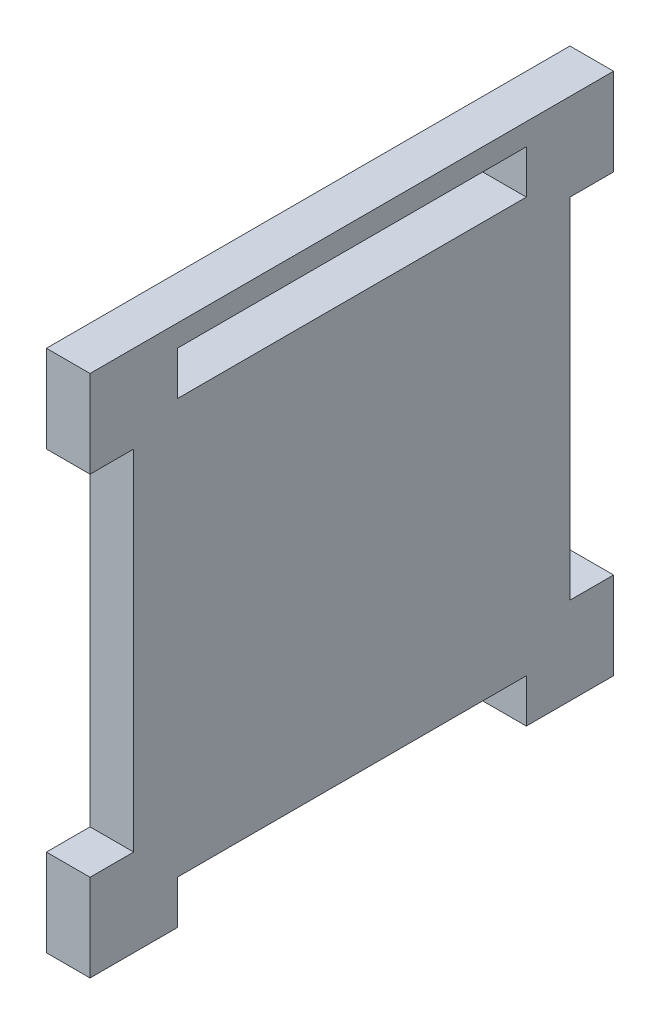
from build123d import *

# Parameters (mm, degrees)
SKETCH1_W           = 6.35
SKETCH1_H           = 76.2
BOSS_EXTRUDE1_DEPTH = 63.5
SKETCH2_W           = 6.35
SKETCH2_H           = 12.7
BOSS_EXTRUDE2_DEPTH = 6.35
SKETCH3_W           = 50.8
SKETCH3_H           = 6.35
CUT_EXTRUDE1_DEPTH  = 80.818262321


with BuildPart() as part:
    # Sketch1 → Boss-Extrude1 (new body)
    with BuildSketch(Plane.XY):
        with Locations((111.125, 0)):
            Rectangle(SKETCH1_W, SKETCH1_H)
    extrude(amount=BOSS_EXTRUDE1_DEPTH)

    # Sketch2 → Boss-Extrude2 (add)
    with BuildSketch(Plane(origin=(114.3, 0, 0), x_dir=(0, 0, -1), z_dir=(1, 0, 0))):
        with Locations((-66.675, -31.75)):
            Rectangle(SKETCH2_W, SKETCH2_H)
        with Locations((-66.675, 31.75)):
            Rectangle(SKETCH2_W, SKETCH2_H)
        with Locations((3.175, 31.75)):
            Rectangle(SKETCH2_W, SKETCH2_H)
        with Locations((3.175, -31.75)):
            Rectangle(SKETCH2_W, SKETCH2_H)
    extrude(amount=-BOSS_EXTRUDE2_DEPTH)

    # Sketch3 → Cut-Extrude1 (cut, through all)
    with BuildSketch(Plane(origin=(114.3, 0, 0), x_dir=(0, 0, -1), z_dir=(1, 0, 0))):
        with Locations((-31.75, 31.75)):
            Rectangle(SKETCH3_W, SKETCH3_H)
        with Locations((-31.75, -34.925)):
            Rectangle(SKETCH3_W, SKETCH3_H)
    extrude(amount=-CUT_EXTRUDE1_DEPTH, mode=Mode.SUBTRACT)


solid = part.part
